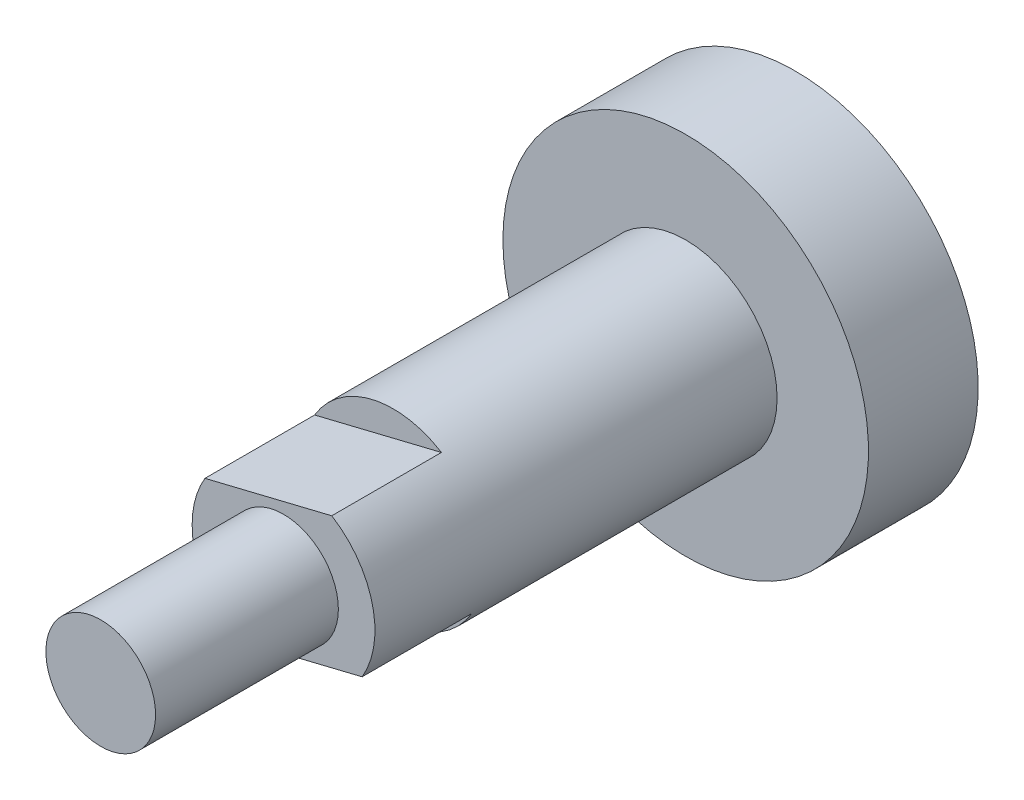
from build123d import *

# Parameters (mm, degrees)
SKETCH1_R           = 5
BOSS_EXTRUDE1_DEPTH = 22
CUT_EXTRUDE1_START  = -6
CUT_EXTRUDE1_DEPTH  = 6
SKETCH3_R           = 3
BOSS_EXTRUDE2_DEPTH = 10
SKETCH4_R           = 10
BOSS_EXTRUDE3_DEPTH = 6


with BuildPart() as part:
    # Sketch1 → Boss-Extrude1 (new body)
    with BuildSketch(Plane.XY):
        Circle(SKETCH1_R)
    extrude(amount=BOSS_EXTRUDE1_DEPTH)

    # Sketch2 → Cut-Extrude1 (cut)
    with BuildSketch(Plane.XY.offset(22).offset(CUT_EXTRUDE1_START)):
        with BuildLine():
            Line((2.638277831, 4.247292089), (-4.299208102, 2.552804281))
            ThreePointArc((-4.299208102, 2.552804281), (-1.186378765, 4.857211693), (2.638277831, 4.247292089))
        make_face()
        with BuildLine():
            Line((-2.638277831, -4.247292089), (4.299208102, -2.552804281))
            ThreePointArc((4.299208102, -2.552804281), (1.186378765, -4.857211693), (-2.638277831, -4.247292089))
        make_face()
    extrude(amount=CUT_EXTRUDE1_DEPTH, mode=Mode.SUBTRACT)

    # Sketch3 → Boss-Extrude2 (add)
    with BuildSketch(Plane.XY.offset(22)):
        Circle(SKETCH3_R)
    extrude(amount=BOSS_EXTRUDE2_DEPTH)

    # Sketch4 → Boss-Extrude3 (add)
    with BuildSketch(Plane(origin=(0, 0, 0), x_dir=(-1, 0, 0), z_dir=(0, 0, -1))):
        Circle(SKETCH4_R)
    extrude(amount=BOSS_EXTRUDE3_DEPTH)


solid = part.part
